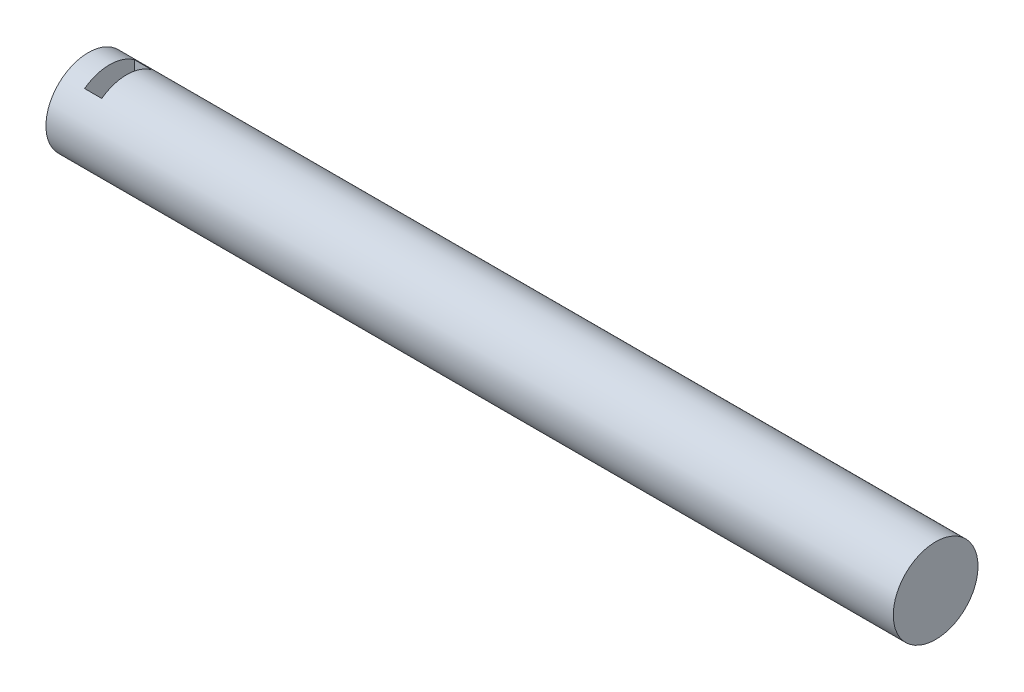
from build123d import *

# Parameters (mm, degrees)
SKETCH2_R           = 20
BOSS_EXTRUDE1_DEPTH = 400
SKETCH3_W           = 8.124111934
SKETCH3_H           = 23.526074142
CUT_EXTRUDE1_DEPTH  = 24
SKETCH5_W           = 21.791522519
SKETCH5_H           = 7.386956786
CUT_EXTRUDE2_DEPTH  = 17
SKETCH5_2_W         = 21.791522519
SKETCH5_2_H         = 7.386956786
CUT_EXTRUDE3_DEPTH  = 11


with BuildPart() as part:
    # Sketch2 → Boss-Extrude1 (new body)
    with BuildSketch(Plane(origin=(0, 0, 0), x_dir=(0, 0, -1), z_dir=(1, 0, 0))):
        Circle(SKETCH2_R)
    extrude(amount=BOSS_EXTRUDE1_DEPTH)

    # Sketch3 → Cut-Extrude1 (cut)
    with BuildSketch(Plane(origin=(0, 20, 0), x_dir=(1, 0, 0), z_dir=(0, 1, 0))):
        with Locations((14.062055967, -0.008909978)):
            Rectangle(SKETCH3_W, SKETCH3_H)
    extrude(amount=-CUT_EXTRUDE1_DEPTH, mode=Mode.SUBTRACT)

    # Sketch5 → Cut-Extrude2 (cut)
    with BuildSketch(Plane.ZY.offset(-18.124111934)):
        with Locations((-0.659549714, -0.342965851)):
            Rectangle(SKETCH5_W, SKETCH5_H)
    extrude(amount=-CUT_EXTRUDE2_DEPTH, mode=Mode.SUBTRACT)

    # Sketch5<2> → Cut-Extrude3 (cut)
    with BuildSketch(Plane.ZY.offset(-18.124111934)):
        with Locations((-0.659549714, -0.342965851)):
            Rectangle(SKETCH5_2_W, SKETCH5_2_H)
    extrude(amount=CUT_EXTRUDE3_DEPTH, mode=Mode.SUBTRACT)


solid = part.part
